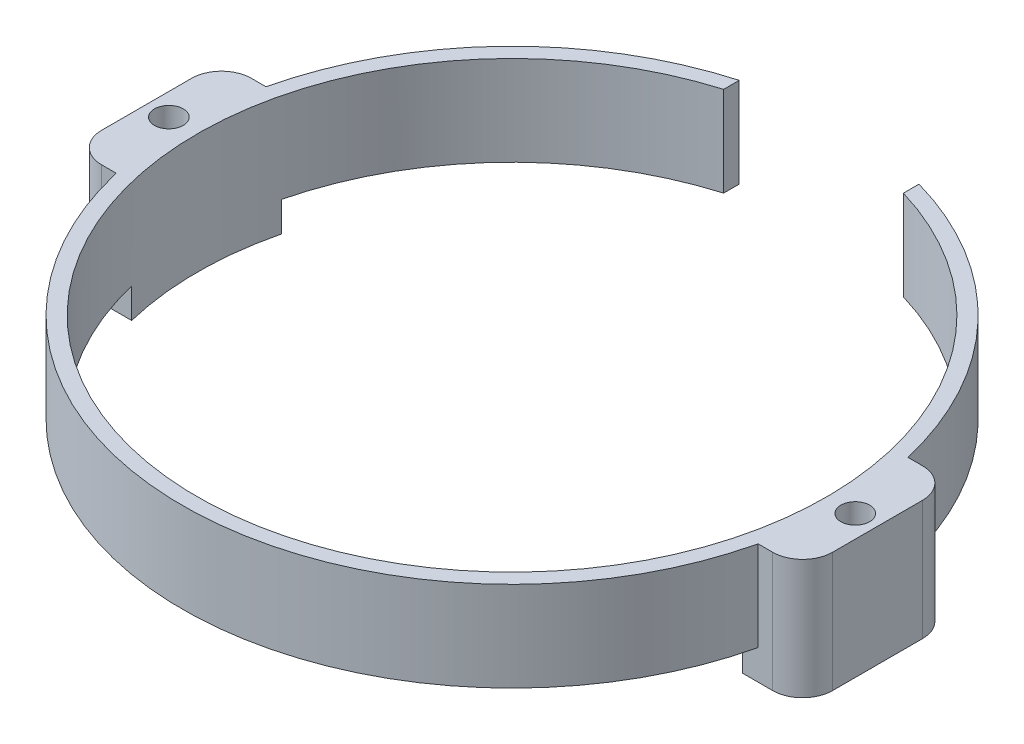
from build123d import *
from build123d.topology import SkipClean

# Parameters (mm, degrees)
BOSS_EXTRUDE1_DEPTH      = 10
BOSS_EXTRUDE1_DEPTH_BACK = 5
SKETCH1_R                = 55
SKETCH1_R_2              = 52.5
CUT_EXTRUDE2_DEPTH       = 80.214898
BOSS_EXTRUDE4_START      = -20
BOSS_EXTRUDE4_DEPTH      = 20
SKETCH7_R                = 2.4
CUT_EXTRUDE4_DEPTH       = 85.526942
FILLET1_R                = 5


with BuildPart() as part:
    # Sketch1 → Boss-Extrude1 (new, two sides: drawn at the far end of the back side and taken through both)
    with BuildSketch(Plane(origin=(0, 0, 0), x_dir=(1, 0, 0), z_dir=(0, 1, 0)).offset(-BOSS_EXTRUDE1_DEPTH_BACK)):
        Circle(SKETCH1_R)
        Circle(SKETCH1_R_2, mode=Mode.SUBTRACT)
    extrude(amount=BOSS_EXTRUDE1_DEPTH + BOSS_EXTRUDE1_DEPTH_BACK)

    # Sketch2 → Cut-Extrude2 (cut, through all)
    with BuildSketch(Plane(origin=(0, 10, 0), x_dir=(1, 0, 0), z_dir=(0, 1, 0))):
        Polygon((0, 0), (-15, 0), (-15, 70), (15, 70), (15, 0), align=None)
    extrude(amount=-CUT_EXTRUDE2_DEPTH, mode=Mode.SUBTRACT)

    # Sketch6 → Boss-Extrude4 (add)
    with SkipClean():  # the faces are left unmerged after this step: merging them gives an invalid solid
        with BuildSketch(Plane(origin=(0, 10, 0), x_dir=(1, 0, 0), z_dir=(0, 1, 0)).offset(BOSS_EXTRUDE4_START)):
            with BuildLine():
                Line((50.990195, 12.5), (60.990195, 12.5))
                Line((60.990195, 12.5), (60.990195, -12.5))
                Line((60.990195, -12.5), (50.990195, -12.5))
                ThreePointArc((50.990195, -12.5), (52.5, 0), (50.990195, 12.5))
            make_face()
            with BuildLine():
                Line((-60.990195, -12.5), (-50.990195, -12.5))
                ThreePointArc((-50.990195, -12.5), (-52.5, 0), (-50.990195, 12.5))
                Line((-50.990195, 12.5), (-60.990195, 12.5))
                Line((-60.990195, 12.5), (-60.990195, -12.5))
            make_face()
        extrude(amount=BOSS_EXTRUDE4_DEPTH)

    # Sketch7 → Cut-Extrude4 (cut, through all)
    with SkipClean():  # the faces are left unmerged after this step: merging them gives an invalid solid
        with BuildSketch(Plane(origin=(0, 10, 0), x_dir=(1, 0, 0), z_dir=(0, 1, 0))):
            with Locations((-57.275454, 0)):
                Circle(SKETCH7_R)
            with Locations((57.275454, 0)):
                Circle(SKETCH7_R)
        extrude(amount=-CUT_EXTRUDE4_DEPTH, mode=Mode.SUBTRACT)

    # Fillet1
    fillet1_edges = [part.edges().sort_by_distance(p)[0] for p in [
        (60.990195, 0, -12.5),
        (60.990195, 0, 12.5),
        (-60.990195, 0, 12.5),
        (-60.990195, 0, -12.5),
    ]]
    fillet(fillet1_edges, radius=FILLET1_R)


solid = part.part
